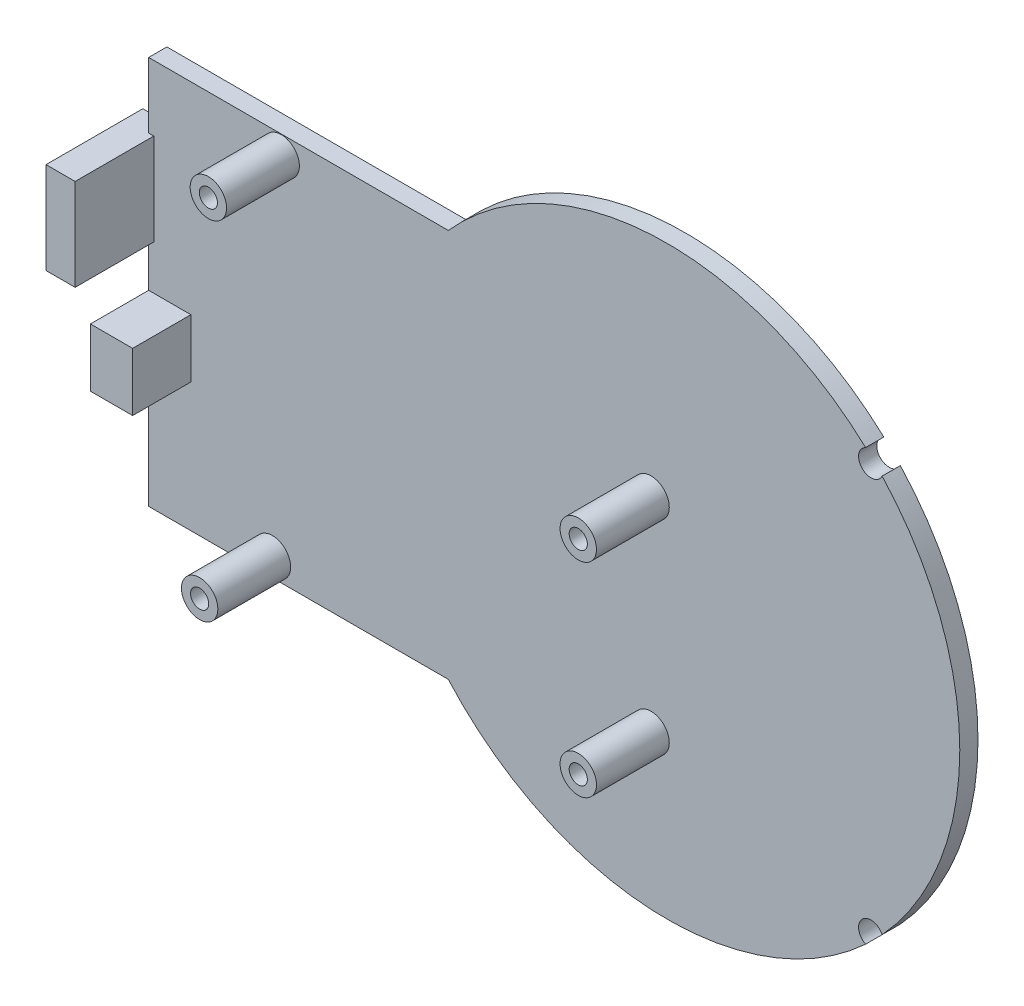
from build123d import *

# Parameters (mm, degrees)
SKETCH2_W           = 51.2
SKETCH2_H           = 53.4
BOSS_EXTRUDE2_DEPTH = 2.5
SKETCH3_R           = 40.2
BOSS_EXTRUDE3_DEPTH = 2.5
SKETCH4_R           = 2.5
BOSS_EXTRUDE4_DEPTH = 10
SKETCH5_W           = 5.8
SKETCH5_H           = 8
BOSS_EXTRUDE5_DEPTH = 8
SKETCH6_R           = 1.25
SKETCH6_R_2         = 1.7
CUT_EXTRUDE1_DEPTH  = 83.714750801
SKETCH7_R           = 2.1
CUT_EXTRUDE2_DEPTH  = 5.2
SKETCH8_W           = 4
SKETCH8_H           = 12.6
BOSS_EXTRUDE6_DEPTH = 13.3


with BuildPart() as part:
    # Sketch2 → Boss-Extrude2 (new body)
    with BuildSketch(Plane.XY.offset(6)):
        with Locations((-45.6, 0)):
            Rectangle(SKETCH2_W, SKETCH2_H)
    extrude(amount=BOSS_EXTRUDE2_DEPTH)

    # Sketch3 → Boss-Extrude3 (add)
    with BuildSketch(Plane.XY.offset(6)):
        Circle(SKETCH3_R)
    extrude(amount=BOSS_EXTRUDE3_DEPTH)

    # Sketch4 → Boss-Extrude4 (add)
    with BuildSketch(Plane.XY.offset(8.5)):
        with Locations((-54.2, -24.17)):
            Circle(SKETCH4_R)
        with Locations((-53, 24.13)):
            Circle(SKETCH4_R)
        with Locations((-2.2, -19.07)):
            Circle(SKETCH4_R)
        with Locations((-2.2, 8.93)):
            Circle(SKETCH4_R)
    extrude(amount=BOSS_EXTRUDE4_DEPTH)

    # Sketch5 → Boss-Extrude5 (add)
    with BuildSketch(Plane.XY.offset(8.5)):
        with Locations((-68.3, -5)):
            Rectangle(SKETCH5_W, SKETCH5_H)
    extrude(amount=BOSS_EXTRUDE5_DEPTH)

    # Sketch6 → Cut-Extrude1 (cut, through all)
    with BuildSketch(Plane.XY.offset(6)):
        with Locations((-54.2, -24.17)):
            Circle(SKETCH6_R)
        with Locations((-53, 24.13)):
            Circle(SKETCH6_R)
        with Locations((-2.2, -19.07)):
            Circle(SKETCH6_R)
        with Locations((-2.2, 8.93)):
            Circle(SKETCH6_R)
        with Locations((28, 28)):
            Circle(SKETCH6_R_2)
        with Locations((28, -28)):
            Circle(SKETCH6_R_2)
    extrude(amount=CUT_EXTRUDE1_DEPTH, mode=Mode.SUBTRACT)

    # Sketch7 → Cut-Extrude2 (cut)
    with BuildSketch(Plane(origin=(-71.2, 0, 0), x_dir=(0, 0, -1), z_dir=(1, 0, 0))):
        with Locations((-12.5, -5)):
            Circle(SKETCH7_R)
    extrude(amount=CUT_EXTRUDE2_DEPTH, mode=Mode.SUBTRACT)

    # Sketch8 → Boss-Extrude6 (add)
    with BuildSketch(Plane.XY.offset(6)):
        with Locations((-72.5, 11.4)):
            Rectangle(SKETCH8_W, SKETCH8_H)
    extrude(amount=BOSS_EXTRUDE6_DEPTH)


solid = part.part
